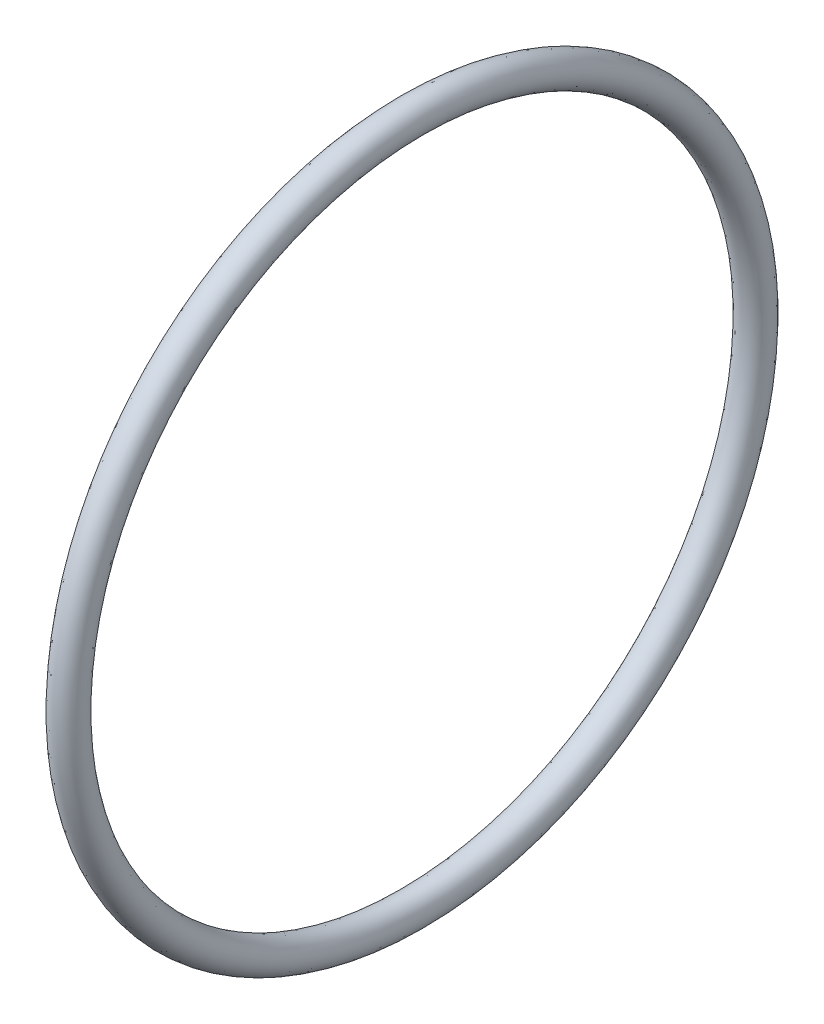
from build123d import *

# Parameters (mm, degrees)
SKETCH3_RX = 1.7653
SKETCH3_RY = 1.7653


with BuildPart() as part:
    # Sketch3 → Revolve1 (revolve)
    with BuildSketch(Plane.XY):
        with Locations(Location((0, 38.1381), (0, 0, 90))):
            Ellipse(SKETCH3_RX, SKETCH3_RY)
    revolve(axis=Axis((0, 0, 0), (-1, 0, 0)))


solid = part.part
